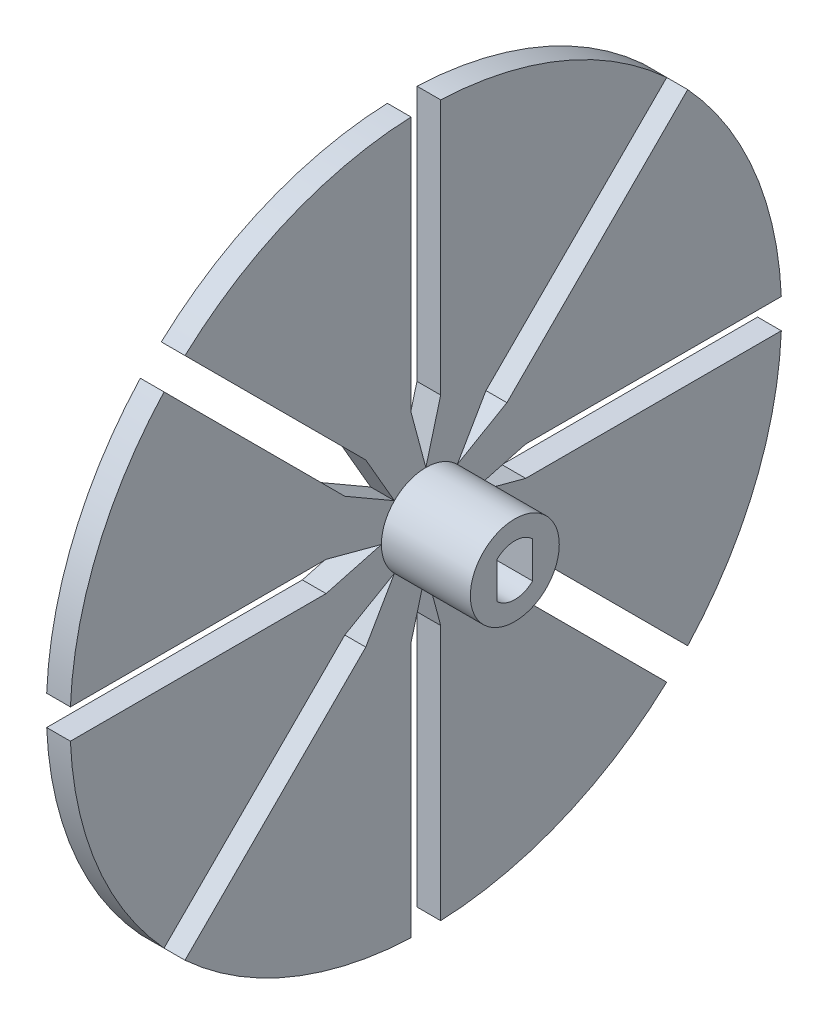
from build123d import *

# Parameters (mm, degrees)
SKETCH1_R           = 4.7625
BOSS_EXTRUDE1_DEPTH = 9.525
SKETCH2_R           = 38.1
BOSS_EXTRUDE2_DEPTH = 2.54
CUT_EXTRUDE1_DEPTH  = 55.716959208
CIRPATTERN1_COUNT   = 8


with BuildPart() as part:
    # Sketch1 → Boss-Extrude1 (new body)
    with BuildSketch(Plane(origin=(0, 0, 0), x_dir=(0, 0, -1), z_dir=(1, 0, 0))):
        with Locations(Location((0, 0, 0), (0, 0, 180))):
            Circle(SKETCH1_R)
        with BuildLine():
            Line((-1.905, -1.956171069), (-1.905, 1.956171069))
            ThreePointArc((-1.905, 1.956171069), (0, 2.7305), (1.905, 1.956171069))
            Line((1.905, 1.956171069), (1.905, -1.956171069))
            ThreePointArc((1.905, -1.956171069), (0, -2.7305), (-1.905, -1.956171069))
        make_face(mode=Mode.SUBTRACT)
    extrude(amount=BOSS_EXTRUDE1_DEPTH)

    # Sketch2 → Boss-Extrude2 (add)
    with BuildSketch(Plane.ZY):
        Circle(SKETCH2_R)
    extrude(amount=BOSS_EXTRUDE2_DEPTH)

    # Sketch3 → Cut-Extrude1 (cut, symmetric)
    with BuildSketch(Plane(origin=(0, 0, 0), x_dir=(0, 0, -1), z_dir=(1, 0, 0))):
        Polygon((-1.5875, 10.687130657), (0, 4.7625), (1.5875, 10.687130657), (1.5875, 38.1), (-1.5875, 38.1), align=None)
    cut_extrude1 = extrude(amount=CUT_EXTRUDE1_DEPTH, both=True, mode=Mode.SUBTRACT)

    # CirPattern1: Cut-Extrude1 ×8 about axis
    cirpattern1_axis = Axis((0, 0, 0), (1, 0, 0))
    for i in range(1, CIRPATTERN1_COUNT):
        add(cut_extrude1.rotate(cirpattern1_axis, i * 360 / CIRPATTERN1_COUNT), mode=Mode.SUBTRACT)


solid = part.part
